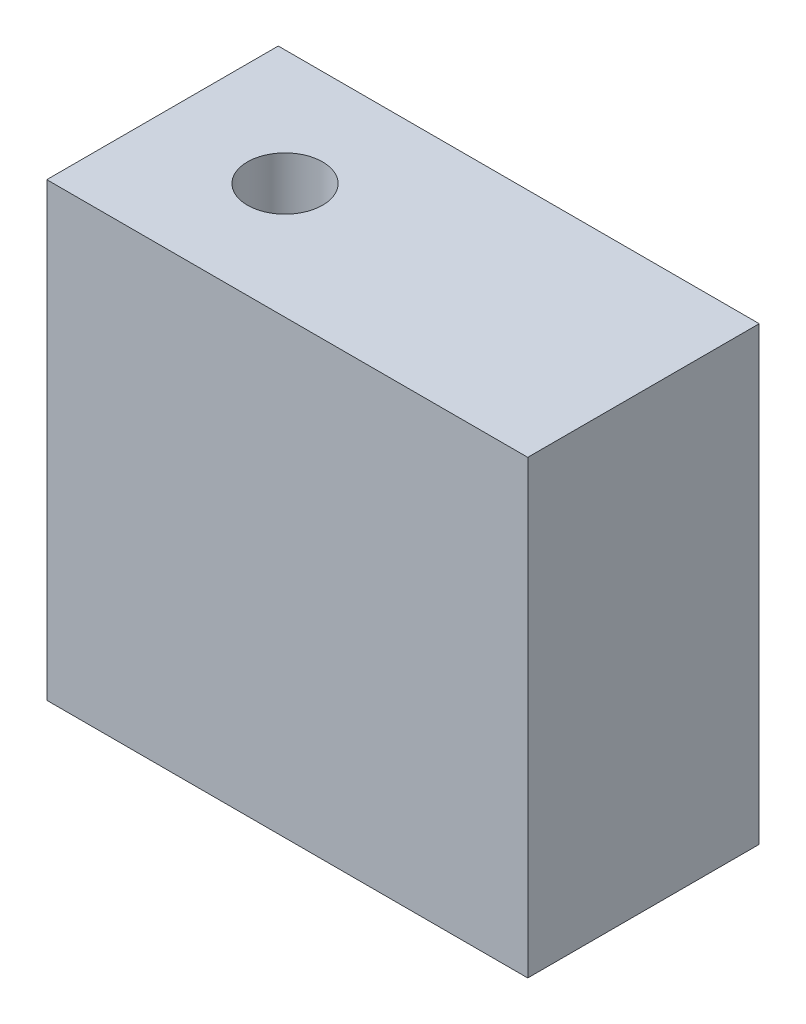
from build123d import *

# Parameters (mm, degrees)
SKETCH1_W           = 40.64
SKETCH1_H           = 19.558
BOSS_EXTRUDE1_DEPTH = 38.1
SKETCH2_R           = 3.175
CUT_EXTRUDE1_DEPTH  = 12.7


with BuildPart() as part:
    # Sketch1 → Boss-Extrude1 (new body)
    with BuildSketch(Plane(origin=(0, 0, 0), x_dir=(1, 0, 0), z_dir=(0, 1, 0))):
        with Locations((-20.32, -9.779)):
            Rectangle(SKETCH1_W, SKETCH1_H)
    extrude(amount=BOSS_EXTRUDE1_DEPTH)

    # Sketch2 → Cut-Extrude1 (cut)
    with BuildSketch(Plane(origin=(0, 38.1, 0), x_dir=(1, 0, 0), z_dir=(0, 1, 0))):
        with Locations(Location((-30.2895, -9.779, 0), (0, 0, 270))):
            Circle(SKETCH2_R)
    extrude(amount=-CUT_EXTRUDE1_DEPTH, mode=Mode.SUBTRACT)


solid = part.part
